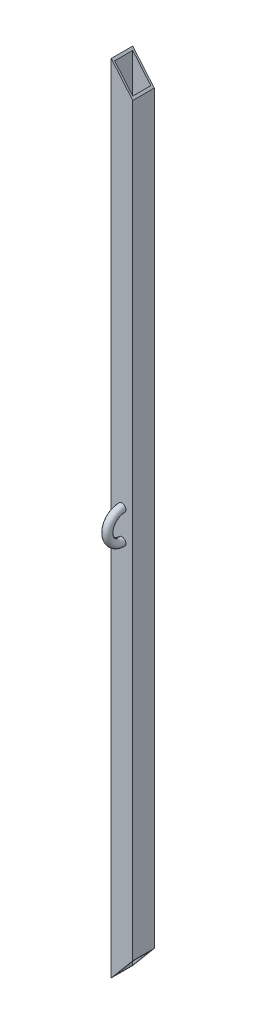
from build123d import *

# Parameters (mm, degrees)
SKETCH2_W           = 31.75
SKETCH2_H           = 31.75
SKETCH2_W_2         = 26.67
SKETCH2_H_2         = 26.67
BOSS_EXTRUDE1_DEPTH = 1174.75
CUT_EXTRUDE1_DEPTH  = 1176.286195199
SKETCH8_R           = 5.842


with BuildPart() as part:
    # Sketch2 → Boss-Extrude1 (new body)
    with BuildSketch(Plane(origin=(0, 0, 0), x_dir=(1, 0, 0), z_dir=(0, 1, 0))):
        Rectangle(SKETCH2_W, SKETCH2_H)
        Rectangle(SKETCH2_W_2, SKETCH2_H_2, mode=Mode.SUBTRACT)
    extrude(amount=BOSS_EXTRUDE1_DEPTH)

    # Sketch4 → Cut-Extrude1 (cut, through all)
    with BuildSketch(Plane.XY.offset(15.875)):
        Polygon((15.875, 0), (15.875, 37.838176565), (-15.875, 0), align=None)
        Polygon((15.875, 1174.75), (15.875, 1136.911823435), (-15.875, 1174.75), align=None)
    extrude(amount=-CUT_EXTRUDE1_DEPTH, mode=Mode.SUBTRACT)

    # Sweep2: sweep along a path in Sketch7
    with BuildLine(Plane(origin=(0, 0, 0), x_dir=(0, 0, -1), z_dir=(1, 0, 0))) as sweep2_path:
        ThreePointArc((-15.875, 608.965), (-37.465, 587.375), (-15.875, 565.785))
    # Sketch8 → Sweep2 (sweep)
    with BuildSketch(Plane.XY.offset(15.875)):
        with Locations((0, 608.965)):
            Circle(SKETCH8_R)
    sweep(path=sweep2_path.line)


solid = part.part
